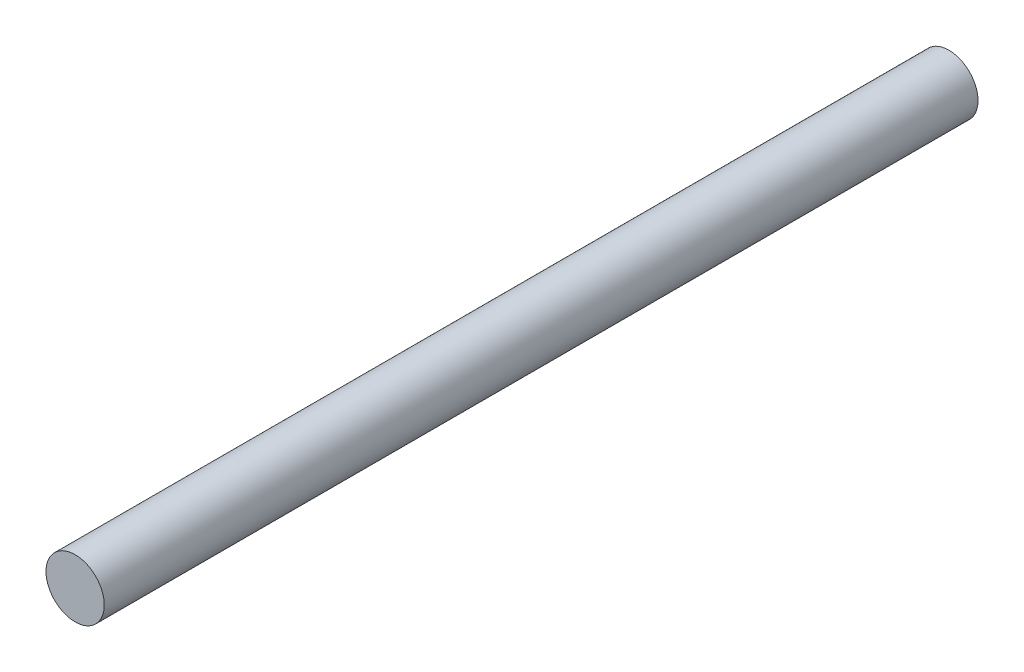
from build123d import *

# Parameters (mm, degrees)
SKETCH1_R           = 6
BOSS_EXTRUDE1_DEPTH = 180


with BuildPart() as part:
    # Sketch1 → Boss-Extrude1 (new body)
    with BuildSketch(Plane.XY):
        with Locations(Location((0, 0, 0), (0, 0, 180))):
            Circle(SKETCH1_R)
    extrude(amount=BOSS_EXTRUDE1_DEPTH)


solid = part.part
